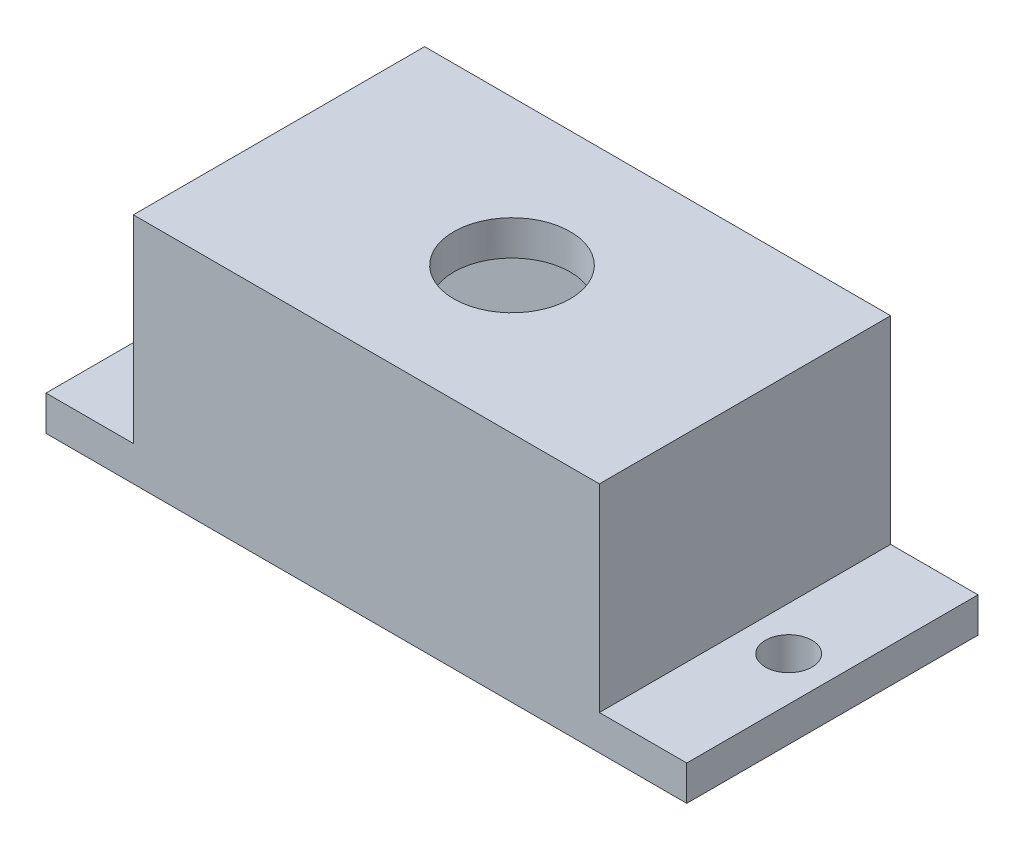
from build123d import *

# Parameters (mm, degrees)
SKETCH_1_W          = 110
SKETCH_1_H          = 50
EXTRUDE_1_DEPTH     = 6
SKETCH_2_W          = 80
SKETCH_2_H          = 50
EXTRUDE_2_DEPTH     = 34
SKETCH_3_W          = 70
SKETCH_3_H          = 40
CUT_EXTRUDE_1_DEPTH = 28
SKETCH_4_R          = 10
CUT_EXTRUDE_2_DEPTH = 73.456883731
SKETCH_5_R          = 4
CUT_EXTRUDE_3_DEPTH = 111
SKETCH_6_W          = 70
SKETCH_6_H          = 40
CUT_EXTRUDE_4_DEPTH = 6


with BuildPart() as part:
    # 草图1 → 凸台-拉伸1 (new body)
    with BuildSketch(Plane(origin=(0, 0, 0), x_dir=(1, 0, 0), z_dir=(0, 1, 0))):
        Rectangle(SKETCH_1_W, SKETCH_1_H)
    extrude(amount=EXTRUDE_1_DEPTH)

    # 草图2 → 凸台-拉伸2 (add)
    with BuildSketch(Plane(origin=(0, 6, 0), x_dir=(1, 0, 0), z_dir=(0, 1, 0))):
        Rectangle(SKETCH_2_W, SKETCH_2_H)
    extrude(amount=EXTRUDE_2_DEPTH)

    # 草图3 → 切除-拉伸1 (cut)
    with BuildSketch(Plane(origin=(0, 6, 0), x_dir=(1, 0, 0), z_dir=(0, 1, 0))):
        Rectangle(SKETCH_3_W, SKETCH_3_H)
    extrude(amount=CUT_EXTRUDE_1_DEPTH, mode=Mode.SUBTRACT)

    # 草图4 → 切除-拉伸2 (cut, through all)
    with BuildSketch(Plane(origin=(0, 40, 0), x_dir=(1, 0, 0), z_dir=(0, 1, 0))):
        with Locations(Location((0, 0, 0), (0, 0, 270))):
            Circle(SKETCH_4_R)
    extrude(amount=-CUT_EXTRUDE_2_DEPTH, mode=Mode.SUBTRACT)

    # 草图5 → 切除-拉伸3 (cut, symmetric)
    with BuildSketch(Plane(origin=(0, 6, 0), x_dir=(1, 0, 0), z_dir=(0, 1, 0))):
        with Locations(Location((-47.5, 0, 0), (0, 0, 90))):
            Circle(SKETCH_5_R)
        with Locations(Location((47.5, 0, 0), (0, 0, 90))):
            Circle(SKETCH_5_R)
    extrude(amount=CUT_EXTRUDE_3_DEPTH, both=True, mode=Mode.SUBTRACT)

    # 草图6 → 切除-拉伸4 (cut)
    with BuildSketch(Plane(origin=(0, 0, 0), x_dir=(1, 0, 0), z_dir=(0, 1, 0))):
        Rectangle(SKETCH_6_W, SKETCH_6_H)
    extrude(amount=CUT_EXTRUDE_4_DEPTH, mode=Mode.SUBTRACT)


solid = part.part
